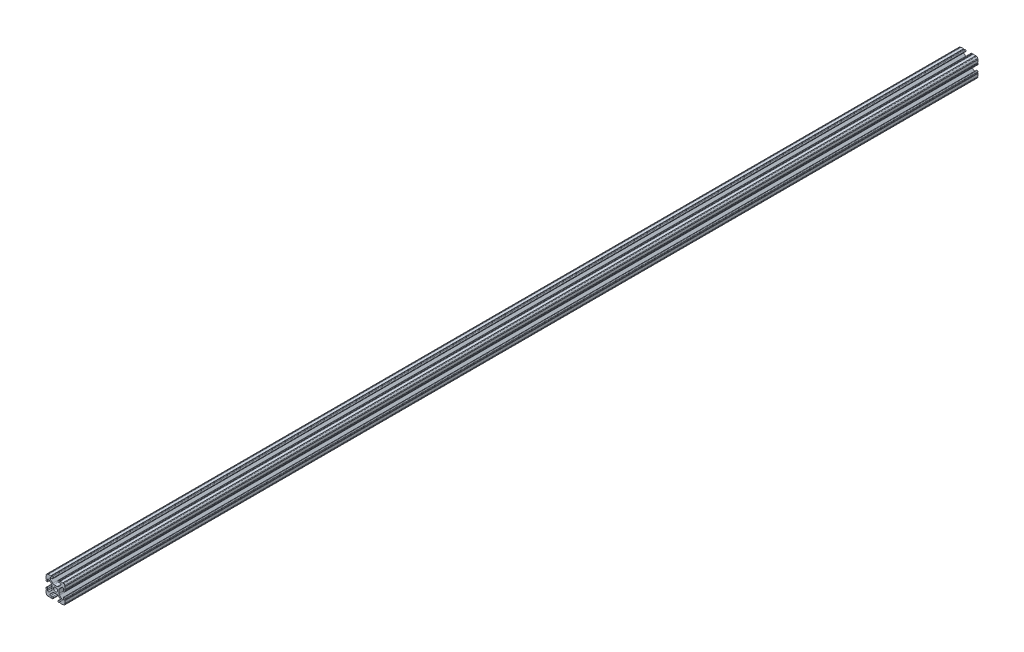
from build123d import *

# Parameters (mm, degrees)
BOSS_EXTRUDE1_DEPTH     = 609.6
CUT_EXTRUDE1_DEPTH      = 610.86452594
CUT_EXTRUDE1_DEPTH_BACK = 610.86452594
SKETCH5_R               = 0.55245


with BuildPart() as part:
    # Sketch4 → Boss-Extrude1 (new, symmetric)
    with BuildSketch(Plane.XY):
        with BuildLine():
            Line((4.190365, -12.7), (10.11729625, -12.7))
            ThreePointArc((10.11729625, -12.7), (11.943543585, -11.943543585), (12.7, -10.11729625))
            Line((12.7, -10.11729625), (12.7, -4.190365))
            ThreePointArc((12.7, -4.190365), (12.42492494, -3.52627506), (11.760835, -3.2512))
            Line((11.760835, -3.2512), (11.429365, -3.2512))
            ThreePointArc((11.429365, -3.2512), (10.76527506, -3.52627506), (10.4902, -4.190365))
            Line((10.4902, -4.190365), (10.4902, -6.348478019))
            ThreePointArc((10.4902, -6.348478019), (9.830707141, -7.335478831), (8.666460301, -7.103895736))
            Line((8.666460301, -7.103895736), (5.299899128, -3.737334563))
            ThreePointArc((5.299899128, -3.737334563), (4.817571085, -3.015479634), (4.6482, -2.16399369))
            Line((4.6482, -2.16399369), (4.6482, 0))
            Line((4.6482, 0), (2.6035, 0))
            ThreePointArc((2.6035, 0), (1.840952505, -1.840952505), (0, -2.6035))
            Line((0, -2.6035), (0, -4.6482))
            Line((0, -4.6482), (2.16399369, -4.6482))
            ThreePointArc((2.16399369, -4.6482), (3.015479634, -4.817571085), (3.737334563, -5.299899128))
            Line((3.737334563, -5.299899128), (7.103895736, -8.666460301))
            ThreePointArc((7.103895736, -8.666460301), (7.335478831, -9.830707141), (6.348478019, -10.4902))
            Line((6.348478019, -10.4902), (4.190365, -10.4902))
            ThreePointArc((4.190365, -10.4902), (3.52627506, -10.76527506), (3.2512, -11.429365))
            Line((3.2512, -11.429365), (3.2512, -11.760835))
            ThreePointArc((3.2512, -11.760835), (3.52627506, -12.42492494), (4.190365, -12.7))
        make_face()
    extrude(amount=BOSS_EXTRUDE1_DEPTH, both=True)

    # Sketch5 → Cut-Extrude1 (cut, two sides: drawn at the far end of the back side and taken through both)
    with BuildSketch(Plane.XY.offset(-CUT_EXTRUDE1_DEPTH_BACK)):
        with Locations((10.356153152, -12.7)):
            Circle(SKETCH5_R)
        with Locations((5.796028019, -12.7)):
            Circle(SKETCH5_R)
        with Locations((12.7, -10.356153152)):
            Circle(SKETCH5_R)
        with Locations((12.7, -5.796028019)):
            Circle(SKETCH5_R)
    extrude(amount=CUT_EXTRUDE1_DEPTH + CUT_EXTRUDE1_DEPTH_BACK, mode=Mode.SUBTRACT)

    # Mirror1: part across plane


with BuildPart() as part_1:
    add(part.part)
    add(part.part.mirror(Plane(origin=(0, 0, 0), x_dir=(0, 0, 1), z_dir=(1, 0, 0))))

    # Mirror2: part across plane


with BuildPart() as part_2:
    add(part_1.part)
    add(part_1.part.mirror(Plane.ZX))


solid = part_2.part
